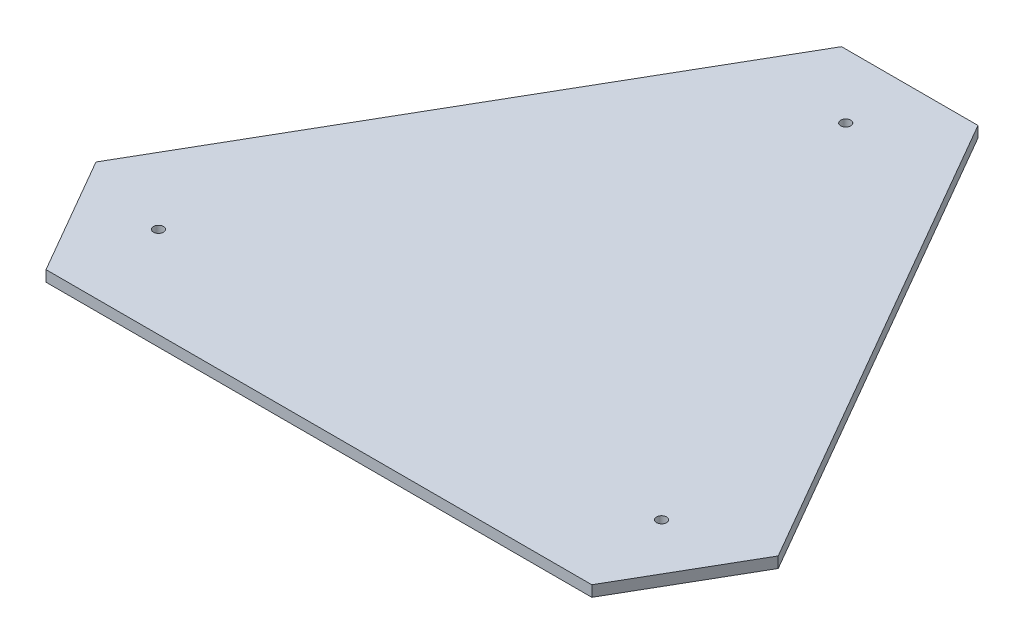
from build123d import *

# Parameters (mm, degrees)
BOSS_EXTRU_1_DEPTH      = 6
ENL_V_MAT_EXTRU_1_REACH = 272.483
ESQUISSE2_R             = 2.75


with BuildPart() as part:
    # Esquisse1 → Boss.-Extru.1 (new body)
    with BuildSketch(Plane(origin=(0, 0, 0), x_dir=(1, 0, 0), z_dir=(0, 1, 0))):
        Polygon((-37.5, 194.855715851), (37.5, 194.855715851), (187.5, -64.951905284), (150, -129.903810568), (-150, -129.903810568), (-187.5, -64.951905284), align=None)
    extrude(amount=BOSS_EXTRU_1_DEPTH)

    # Esquisse2 → Enlèv. mat.-Extru.1 (cut, up to next)
    with BuildSketch(Plane(origin=(0, 6, 0), x_dir=(1, 0, 0), z_dir=(0, 1, 0)), mode=Mode.PRIVATE) as enl_v_mat_extru_1_sk1:
        with Locations(Location((0, 159.641425484, 0), (0, 0, 270))):
            Circle(ESQUISSE2_R)
    enl_v_mat_extru_1_tool1 = extrude(enl_v_mat_extru_1_sk1.sketch, amount=-ENL_V_MAT_EXTRU_1_REACH, mode=Mode.PRIVATE) & part.part
    # Esquisse2 → Enlèv. mat.-Extru.1 (cut, up to next)
    with BuildSketch(Plane(origin=(0, 6, 0), x_dir=(1, 0, 0), z_dir=(0, 1, 0)), mode=Mode.PRIVATE) as enl_v_mat_extru_1_sk2:
        with Locations(Location((-138.253529965, -79.820712742, 0), (0, 0, 270))):
            Circle(ESQUISSE2_R)
    enl_v_mat_extru_1_tool2 = extrude(enl_v_mat_extru_1_sk2.sketch, amount=-ENL_V_MAT_EXTRU_1_REACH, mode=Mode.PRIVATE) & part.part
    # Esquisse2 → Enlèv. mat.-Extru.1 (cut, up to next)
    with BuildSketch(Plane(origin=(0, 6, 0), x_dir=(1, 0, 0), z_dir=(0, 1, 0)), mode=Mode.PRIVATE) as enl_v_mat_extru_1_sk3:
        with Locations(Location((138.253529965, -79.820712742, 0), (0, 0, 270))):
            Circle(ESQUISSE2_R)
    enl_v_mat_extru_1_tool3 = extrude(enl_v_mat_extru_1_sk3.sketch, amount=-ENL_V_MAT_EXTRU_1_REACH, mode=Mode.PRIVATE) & part.part
    add(enl_v_mat_extru_1_tool1.solids().sort_by_distance((0, 6, -159.641425))[0], mode=Mode.SUBTRACT)
    add(enl_v_mat_extru_1_tool2.solids().sort_by_distance((-138.25353, 6, 79.820713))[0], mode=Mode.SUBTRACT)
    add(enl_v_mat_extru_1_tool3.solids().sort_by_distance((138.25353, 6, 79.820713))[0], mode=Mode.SUBTRACT)


solid = part.part
